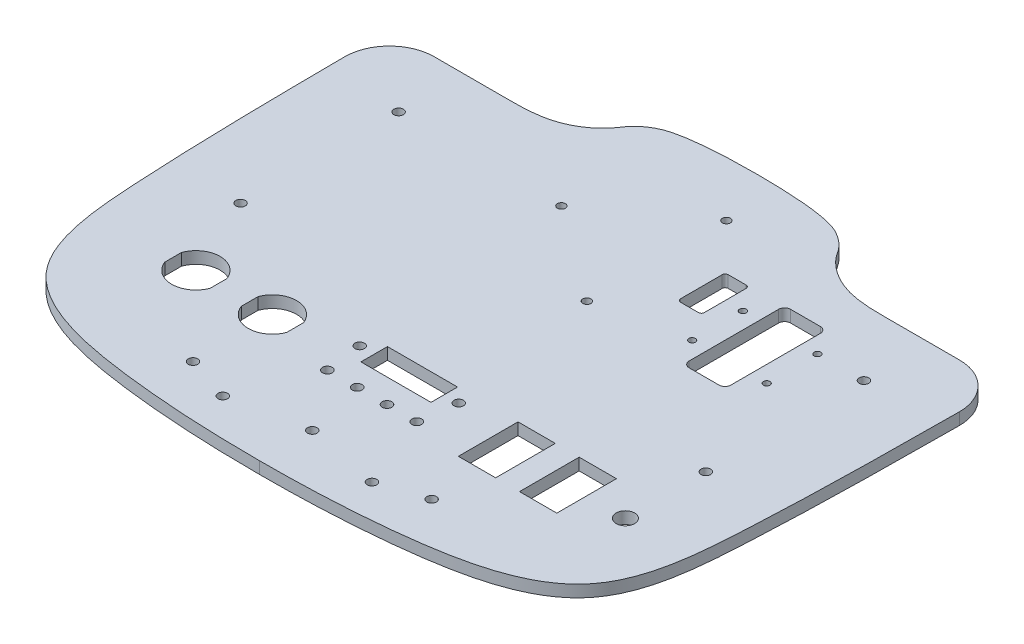
from build123d import *

# Parameters (mm, degrees)
SKETCH1_W           = 240
SKETCH1_H           = 310
BOSS_EXTRUDE1_DEPTH = 4
CUT_EXTRUDE1_START  = -4
CUT_EXTRUDE1_DEPTH  = 4
SKETCH3_W           = 240
SKETCH3_H           = 155
CUT_EXTRUDE2_DEPTH  = 197.06376528
SKETCH14_R          = 1.6
CUT_EXTRUDE10_DEPTH = 197.06376528
BOSS_EXTRUDE3_DEPTH = 4
CUT_EXTRUDE11_DEPTH = 197.06376528
FILLET2_R           = 15
SKETCH18_R          = 1.35
CUT_EXTRUDE12_DEPTH = 10
SKETCH19_R          = 1.1
CUT_EXTRUDE13_DEPTH = 180.242742829
SKETCH20_W          = 8
SKETCH20_H          = 16
CUT_EXTRUDE14_DEPTH = 180.242742829
FILLET3_R           = 1
SKETCH21_R          = 1.6
SKETCH21_W          = 23.5
SKETCH21_H          = 8.9
CUT_EXTRUDE15_DEPTH = 180.242742829
SKETCH22_R          = 3.1
SKETCH22_W          = 12.5
SKETCH22_H          = 20
CUT_EXTRUDE16_DEPTH = 180.242742829
CUT_EXTRUDE17_DEPTH = 180.242742829
SKETCH24_R          = 1.6
CUT_EXTRUDE18_DEPTH = 180.242742829
SKETCH25_R          = 1.625
CUT_EXTRUDE19_DEPTH = 180.242742829


with BuildPart() as part:
    # Sketch1 → Boss-Extrude1 (new body)
    with BuildSketch(Plane(origin=(0, 0, 0), x_dir=(1, 0, 0), z_dir=(0, 1, 0))):
        Rectangle(SKETCH1_W, SKETCH1_H)
    extrude(amount=BOSS_EXTRUDE1_DEPTH)

    # Sketch2 → Cut-Extrude1 (cut)
    with BuildSketch(Plane(origin=(0, 4, 0), x_dir=(1, 0, 0), z_dir=(0, 1, 0)).offset(CUT_EXTRUDE1_START)):
        with BuildLine():
            add(Edge.make_bspline(
                [(0, -155), (-30.572222193, -155), (-80.343316982, -153.733320995), (-119.221157946, -117.654395612), (-120, -45.41001223), (-120, 0)],
                knots=[0, 0, 0, 0, 0.458017491, 0.558017491, 1, 1, 1, 1], degree=3))
            Line((-120, 0), (-120, -155))
            Line((-120, -155), (0, -155))
        make_face()
        with BuildLine():
            Line((120, -155), (120, 0))
            add(Edge.make_bspline(
                [(0, -155), (30.572222193, -155), (80.343316982, -153.733320995), (119.221157946, -117.654395612), (120, -45.41001223), (120, 0)],
                knots=[0, 0, 0, 0, 0.458017491, 0.558017491, 1, 1, 1, 1], degree=3))
            Line((0, -155), (120, -155))
        make_face()
    extrude(amount=CUT_EXTRUDE1_DEPTH, mode=Mode.SUBTRACT)

    # Sketch3 → Cut-Extrude2 (cut, through all)
    with BuildSketch(Plane(origin=(0, 4, 0), x_dir=(1, 0, 0), z_dir=(0, 1, 0))):
        with Locations((0, 77.5)):
            Rectangle(SKETCH3_W, SKETCH3_H)
    extrude(amount=-CUT_EXTRUDE2_DEPTH, mode=Mode.SUBTRACT)

    # Sketch14 → Cut-Extrude10 (cut, through all)
    with BuildSketch(Plane(origin=(0, 4, 0), x_dir=(1, 0, 0), z_dir=(0, 1, 0))):
        with Locations(Location((78, -75, 0), (0, 0, 270))):
            Circle(SKETCH14_R)
        with Locations(Location((78, -22, 0), (0, 0, 270))):
            Circle(SKETCH14_R)
        with Locations(Location((40, -128.95, 0), (0, 0, 270))):
            Circle(SKETCH14_R)
        with Locations(Location((-40, -128.95, 0), (0, 0, 90))):
            Circle(SKETCH14_R)
        with Locations(Location((-78, -75, 0), (0, 0, 90))):
            Circle(SKETCH14_R)
        with Locations(Location((-78, -22, 0), (0, 0, 90))):
            Circle(SKETCH14_R)
    extrude(amount=-CUT_EXTRUDE10_DEPTH, mode=Mode.SUBTRACT)

    # Sketch16 → Boss-Extrude3 (add, through all)
    with BuildSketch(Plane(origin=(0, 4, 0), x_dir=(1, 0, 0), z_dir=(0, 1, 0))):
        with BuildLine():
            Line((-62.5, 0), (62.5, 0))
            add(Edge.make_bspline(
                [(62.5, 0), (56.859259916, 0), (47.566912037, 0.719259662), (37.247807044, 7.965019714), (35.011733166, 13.706266708), (25.174107504, 19.099129057), (11.46146494, 20), (0, 20)],
                knots=[0, 0, 0, 0, 0.283628686, 0.580942943, 0.775947596, 0.817853301, 1, 1, 1, 1], degree=3))
            add(Edge.make_bspline(
                [(-62.5, 0), (-56.859259916, 0), (-47.566912037, 0.719259662), (-37.247807044, 7.965019714), (-35.011733166, 13.706266708), (-25.174107504, 19.099129057), (-11.46146494, 20), (0, 20)],
                knots=[0, 0, 0, 0, 0.283628686, 0.580942943, 0.775947596, 0.817853301, 1, 1, 1, 1], degree=3))
        make_face()
    extrude(amount=-BOSS_EXTRUDE3_DEPTH)

    # Sketch17 → Cut-Extrude11 (cut, through all)
    with BuildSketch(Plane(origin=(0, 4, 0), x_dir=(1, 0, 0), z_dir=(0, 1, 0))):
        with BuildLine():
            Line((103.110137058, 0), (120, 0))
            add(Edge.make_bspline(
                [(0, -155), (30.572222193, -155), (80.343316982, -153.733320995), (119.221157946, -117.654395612), (120, -45.41001223), (120, 0)],
                knots=[0, 0, 0, 0, 0.458017491, 0.558017491, 1, 1, 1, 1], degree=3))
            add(Edge.make_bspline(
                [(0, -155), (-30.572222193, -155), (-80.343316982, -153.733320995), (-119.221157946, -117.654395612), (-120, -45.41001223), (-120, 0)],
                knots=[0, 0, 0, 0, 0.458017491, 0.558017491, 1, 1, 1, 1], degree=3))
            Line((-120, 0), (-103.110137058, 0))
            add(Edge.make_bspline(
                [(0, -146.590313569), (-13.459917165, -146.590313569), (-46.754245971, -145.639494105), (-97.960421981, -134.567499832), (-102.124246572, -80.871354335), (-102.923272875, -39.746916924), (-103.110137058, -11.568258696), (-103.110137058, 0)],
                knots=[0, 0, 0, 0, 0.214534577, 0.42370435, 0.615344084, 0.849411098, 1, 1, 1, 1], degree=3))
            add(Edge.make_bspline(
                [(0, -146.590313569), (13.459917165, -146.590313569), (46.754245971, -145.639494105), (97.960421981, -134.567499832), (102.124246572, -80.871354335), (102.923272875, -39.746916924), (103.110137058, -11.568258696), (103.110137058, 0)],
                knots=[0, 0, 0, 0, 0.214534577, 0.42370435, 0.615344084, 0.849411098, 1, 1, 1, 1], degree=3))
        make_face()
    extrude(amount=-CUT_EXTRUDE11_DEPTH, mode=Mode.SUBTRACT)

    # Fillet2
    fillet2_edges = [part.edges().sort_by_distance(p)[0] for p in [
        (103.110137058, 2, 0),
        (-103.110137058, 2, 0),
    ]]
    fillet(fillet2_edges, radius=FILLET2_R)

    # Sketch18 → Cut-Extrude12 (cut)
    with BuildSketch(Plane(origin=(0, 4, 0), x_dir=(1, 0, 0), z_dir=(0, 1, 0))):
        with Locations(Location((8.5, 1.4, 0), (0, 0, 270))):
            Circle(SKETCH18_R)
        with Locations(Location((8.5, -45.4, 0), (0, 0, 270))):
            Circle(SKETCH18_R)
        with Locations(Location((-23.42, -22, 0), (0, 0, 270))):
            Circle(SKETCH18_R)
    extrude(amount=-CUT_EXTRUDE12_DEPTH, mode=Mode.SUBTRACT)

    # Sketch19 → Cut-Extrude13 (cut, through all)
    with BuildSketch(Plane(origin=(0, 4, 0), x_dir=(1, 0, 0), z_dir=(0, 1, 0))):
        with Locations(Location((37.5, -22.1, 0), (0, 0, 270))):
            Circle(SKETCH19_R)
        with Locations(Location((37.5, -39.1, 0), (0, 0, 90))):
            Circle(SKETCH19_R)
        with Locations(Location((62.5, -39.1, 0), (0, 0, 270))):
            Circle(SKETCH19_R)
        with Locations(Location((62.5, -22.1, 0), (0, 0, 90))):
            Circle(SKETCH19_R)
        with BuildLine():
            Line((45, -13.6), (55, -13.6))
            ThreePointArc((55, -13.6), (56.414213562, -14.185786438), (57, -15.6))
            Line((57, -15.6), (57, -45.6))
            ThreePointArc((57, -45.6), (56.414213562, -47.014213562), (55, -47.6))
            Line((55, -47.6), (45, -47.6))
            ThreePointArc((45, -47.6), (43.585786438, -47.014213562), (43, -45.6))
            Line((43, -45.6), (43, -15.6))
            ThreePointArc((43, -15.6), (43.585786438, -14.185786438), (45, -13.6))
        make_face()
    extrude(amount=-CUT_EXTRUDE13_DEPTH, mode=Mode.SUBTRACT)

    # Sketch20 → Cut-Extrude14 (cut, through all)
    with BuildSketch(Plane(origin=(0, 4, 0), x_dir=(1, 0, 0), z_dir=(0, 1, 0))):
        with Locations((27.5, -22)):
            Rectangle(SKETCH20_W, SKETCH20_H)
    extrude(amount=-CUT_EXTRUDE14_DEPTH, mode=Mode.SUBTRACT)

    # Fillet3
    fillet3_edges = [part.edges().sort_by_distance(p)[0] for p in [
        (23.5, 2, 30),
        (23.5, 2, 14),
        (31.5, 2, 14),
        (31.5, 2, 30),
    ]]
    fillet(fillet3_edges, radius=FILLET3_R)

    # Sketch21 → Cut-Extrude15 (cut, through all)
    with BuildSketch(Plane(origin=(0, 4, 0), x_dir=(1, 0, 0), z_dir=(0, 1, 0))):
        with Locations(Location((-16.6, -96.45, 0), (0, 0, 270))):
            Circle(SKETCH21_R)
        with Locations(Location((16.6, -96.45, 0), (0, 0, 270))):
            Circle(SKETCH21_R)
        with Locations((0, -96.45)):
            Rectangle(SKETCH21_W, SKETCH21_H)
    extrude(amount=-CUT_EXTRUDE15_DEPTH, mode=Mode.SUBTRACT)

    # Sketch22 → Cut-Extrude16 (cut, through all)
    with BuildSketch(Plane(origin=(0, 4, 0), x_dir=(1, 0, 0), z_dir=(0, 1, 0))):
        with Locations(Location((78, -101.975, 0), (0, 0, 270))):
            Circle(SKETCH22_R)
        with Locations((38.25, -101.975)):
            Rectangle(SKETCH22_W, SKETCH22_H)
        with Locations((58.75, -101.975)):
            Rectangle(SKETCH22_W, SKETCH22_H)
    extrude(amount=-CUT_EXTRUDE16_DEPTH, mode=Mode.SUBTRACT)

    # Sketch23 → Cut-Extrude17 (cut, through all)
    with BuildSketch(Plane(origin=(0, 4, 0), x_dir=(1, 0, 0), z_dir=(0, 1, 0))):
        with BuildLine():
            Line((-73.6, -99.173214855), (-73.6, -104.776785145))
            ThreePointArc((-73.6, -104.776785145), (-66, -110.075), (-58.4, -104.776785145))
            Line((-58.4, -104.776785145), (-58.4, -99.173214855))
            ThreePointArc((-58.4, -99.173214855), (-66, -93.875), (-73.6, -99.173214855))
        make_face()
        with BuildLine():
            Line((-47.95, -99.173214855), (-47.95, -104.776785145))
            ThreePointArc((-47.95, -104.776785145), (-40.35, -110.075), (-32.75, -104.776785145))
            Line((-32.75, -104.776785145), (-32.75, -99.173214855))
            ThreePointArc((-32.75, -99.173214855), (-40.35, -93.875), (-47.95, -99.173214855))
        make_face()
    extrude(amount=-CUT_EXTRUDE17_DEPTH, mode=Mode.SUBTRACT)

    # Sketch24 → Cut-Extrude18 (cut, through all)
    with BuildSketch(Plane(origin=(0, 4, 0), x_dir=(1, 0, 0), z_dir=(0, 1, 0))):
        with Locations(Location((-25, -133.95, 0), (0, 0, 270))):
            Circle(SKETCH24_R)
        with Locations(Location((25, -133.95, 0), (0, 0, 270))):
            Circle(SKETCH24_R)
        with Locations(Location((0, -128.95, 0), (0, 0, 270))):
            Circle(SKETCH24_R)
    extrude(amount=-CUT_EXTRUDE18_DEPTH, mode=Mode.SUBTRACT)

    # Sketch25 → Cut-Extrude19 (cut, through all)
    with BuildSketch(Plane(origin=(0, 4, 0), x_dir=(1, 0, 0), z_dir=(0, 1, 0))):
        with Locations(Location((-15, -108.9, 0), (0, 0, 270))):
            Circle(SKETCH25_R)
        with Locations(Location((-5, -108.9, 0), (0, 0, 270))):
            Circle(SKETCH25_R)
        with Locations(Location((5, -108.9, 0), (0, 0, 270))):
            Circle(SKETCH25_R)
        with Locations(Location((15, -108.9, 0), (0, 0, 270))):
            Circle(SKETCH25_R)
    extrude(amount=-CUT_EXTRUDE19_DEPTH, mode=Mode.SUBTRACT)


solid = part.part
